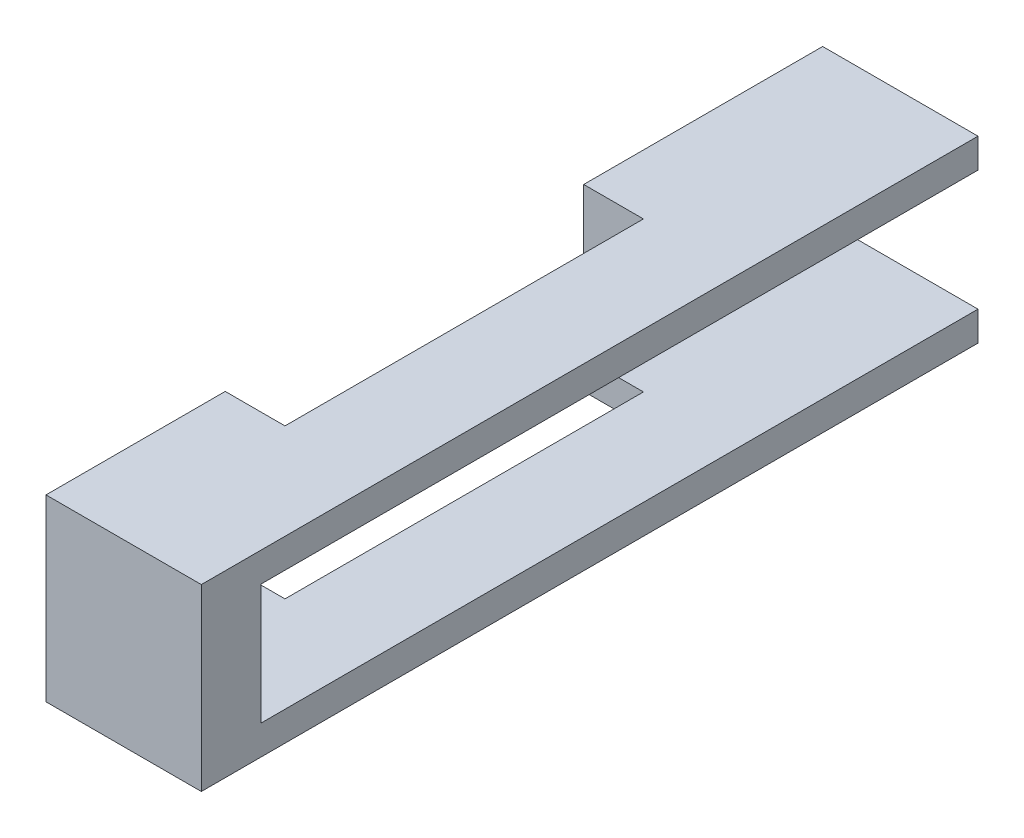
from build123d import *

# Parameters (mm, degrees)
SKETCH_1_W          = 30
SKETCH_1_H          = 30
EXTRUDE_1_DEPTH     = 30
SKETCH_2_W          = 20
SKETCH_2_H          = 20.05
CUT_EXTRUDE_1_DEPTH = 20
CUT_EXTRUDE_2_DEPTH = 20
SKETCH_4_W          = 5
SKETCH_4_H          = 30
CUT_EXTRUDE_3_DEPTH = 55
SKETCH_5_W          = 15
SKETCH_5_H          = 4.975
EXTRUDE_2_DEPTH     = 120
EXTRUDE_3_DEPTH     = 60
SKETCH_7_R          = 3.1
CUT_EXTRUDE_4_DEPTH = 60
CUT_EXTRUDE_5_REACH = 155.704
SKETCH_8_W          = 20.1
SKETCH_8_H          = 20.15
EXTRUDE_4_DEPTH     = 1
SKETCH_10_R         = 3.1
CUT_EXTRUDE_6_DEPTH = 10
SKETCH_12_W         = 26
SKETCH_12_H         = 20
CUT_EXTRUDE_8_DEPTH = 87


with BuildPart() as part:
    # 草图1 → 凸台-拉伸1 (new body)
    with BuildSketch(Plane(origin=(0, 0, 0), x_dir=(1, 0, 0), z_dir=(0, 1, 0))):
        Rectangle(SKETCH_1_W, SKETCH_1_H)
    extrude(amount=EXTRUDE_1_DEPTH)

    # 草图2 → 切除-拉伸1 (cut)
    with BuildSketch(Plane(origin=(15, 0, 0), x_dir=(0, 0, -1), z_dir=(1, 0, 0))):
        with Locations((5, 15)):
            Rectangle(SKETCH_2_W, SKETCH_2_H)
    extrude(amount=-CUT_EXTRUDE_1_DEPTH, mode=Mode.SUBTRACT)

    # 草图3 → 切除-拉伸2 (cut)
    with BuildSketch(Plane(origin=(-5, 0, 0), x_dir=(0, 0, -1), z_dir=(1, 0, 0))):
        with BuildLine():
            ThreePointArc((7.189292698, 17.194765929), (5, 18.1), (2.810707302, 17.194765929))
            Line((2.810707302, 17.194765929), (5, 15))
            Line((5, 15), (7.189292698, 17.194765929))
        make_face()
        with BuildLine():
            Line((5, 15), (2.810707302, 17.194765929))
            ThreePointArc((2.810707302, 17.194765929), (1.9, 15), (2.810707302, 12.805234071))
            Line((2.810707302, 12.805234071), (5, 15))
        make_face()
        with BuildLine():
            Line((7.189292698, 17.194765929), (5, 15))
            Line((5, 15), (7.189292698, 12.805234071))
            ThreePointArc((7.189292698, 12.805234071), (7.86328547, 13.81189381), (8.1, 15))
            ThreePointArc((8.1, 15), (7.86328547, 16.18810619), (7.189292698, 17.194765929))
        make_face()
        with BuildLine():
            Line((7.189292698, 12.805234071), (5, 15))
            Line((5, 15), (2.810707302, 12.805234071))
            ThreePointArc((2.810707302, 12.805234071), (5, 11.9), (7.189292698, 12.805234071))
        make_face()
        with BuildLine():
            ThreePointArc((7.189292698, 17.194765929), (5, 18.1), (2.810707302, 17.194765929))
            Line((2.810707302, 17.194765929), (5, 15))
            Line((5, 15), (7.189292698, 17.194765929))
        make_face()
        with BuildLine():
            Line((5, 15), (2.810707302, 17.194765929))
            ThreePointArc((2.810707302, 17.194765929), (1.9, 15), (2.810707302, 12.805234071))
            Line((2.810707302, 12.805234071), (5, 15))
        make_face()
        with BuildLine():
            Line((7.189292698, 17.194765929), (5, 15))
            Line((5, 15), (7.189292698, 12.805234071))
            ThreePointArc((7.189292698, 12.805234071), (7.86328547, 13.81189381), (8.1, 15))
            ThreePointArc((8.1, 15), (7.86328547, 16.18810619), (7.189292698, 17.194765929))
        make_face()
        with BuildLine():
            Line((7.189292698, 12.805234071), (5, 15))
            Line((5, 15), (2.810707302, 12.805234071))
            ThreePointArc((2.810707302, 12.805234071), (5, 11.9), (7.189292698, 12.805234071))
        make_face()
        with BuildLine():
            ThreePointArc((7.189292698, 17.194765929), (5, 18.1), (2.810707302, 17.194765929))
            Line((2.810707302, 17.194765929), (5, 15))
            Line((5, 15), (7.189292698, 17.194765929))
        make_face()
        with BuildLine():
            Line((5, 15), (2.810707302, 17.194765929))
            ThreePointArc((2.810707302, 17.194765929), (1.9, 15), (2.810707302, 12.805234071))
            Line((2.810707302, 12.805234071), (5, 15))
        make_face()
        with BuildLine():
            Line((7.189292698, 17.194765929), (5, 15))
            Line((5, 15), (7.189292698, 12.805234071))
            ThreePointArc((7.189292698, 12.805234071), (7.86328547, 13.81189381), (8.1, 15))
            ThreePointArc((8.1, 15), (7.86328547, 16.18810619), (7.189292698, 17.194765929))
        make_face()
        with BuildLine():
            Line((7.189292698, 12.805234071), (5, 15))
            Line((5, 15), (2.810707302, 12.805234071))
            ThreePointArc((2.810707302, 12.805234071), (5, 11.9), (7.189292698, 12.805234071))
        make_face()
        with BuildLine():
            ThreePointArc((7.189292698, 17.194765929), (5, 18.1), (2.810707302, 17.194765929))
            Line((2.810707302, 17.194765929), (5, 15))
            Line((5, 15), (7.189292698, 17.194765929))
        make_face()
        with BuildLine():
            Line((5, 15), (2.810707302, 17.194765929))
            ThreePointArc((2.810707302, 17.194765929), (1.9, 15), (2.810707302, 12.805234071))
            Line((2.810707302, 12.805234071), (5, 15))
        make_face()
        with BuildLine():
            Line((7.189292698, 17.194765929), (5, 15))
            Line((5, 15), (7.189292698, 12.805234071))
            ThreePointArc((7.189292698, 12.805234071), (7.86328547, 13.81189381), (8.1, 15))
            ThreePointArc((8.1, 15), (7.86328547, 16.18810619), (7.189292698, 17.194765929))
        make_face()
        with BuildLine():
            Line((7.189292698, 12.805234071), (5, 15))
            Line((5, 15), (2.810707302, 12.805234071))
            ThreePointArc((2.810707302, 12.805234071), (5, 11.9), (7.189292698, 12.805234071))
        make_face()
    extrude(amount=-CUT_EXTRUDE_2_DEPTH, mode=Mode.SUBTRACT)

    # 草图4 → 切除-拉伸3 (cut)
    with BuildSketch(Plane.XZ):
        with Locations((-12.5, 0)):
            Rectangle(SKETCH_4_W, SKETCH_4_H)
    extrude(amount=-CUT_EXTRUDE_3_DEPTH, mode=Mode.SUBTRACT)

    # 草图5 → 凸台-拉伸2 (add)
    with BuildSketch(Plane(origin=(0, 0, -15), x_dir=(-1, 0, 0), z_dir=(0, 0, -1))):
        with Locations((-7.5, 27.5125)):
            Rectangle(SKETCH_5_W, SKETCH_5_H)
        with Locations((-7.5, 2.4875)):
            Rectangle(SKETCH_5_W, SKETCH_5_H)
    extrude(amount=EXTRUDE_2_DEPTH)

    # 草图6 → 凸台-拉伸3 (add)
    with BuildSketch(Plane(origin=(0, 0, -135), x_dir=(-1, 0, 0), z_dir=(0, 0, -1))):
        Polygon((5, 4.975), (0, 4.975), (0, 0), (10, 0), (10, 30), (0, 30), (0, 25.025), (5, 25.025), align=None)
    extrude(amount=-EXTRUDE_3_DEPTH)

    # 草图7 → 切除-拉伸4 (cut)
    with BuildSketch(Plane.ZY.offset(10)):
        with Locations((-85, 15)):
            Circle(SKETCH_7_R)
    extrude(amount=-CUT_EXTRUDE_4_DEPTH, mode=Mode.SUBTRACT)

    # 切除-拉伸5: up to this face of the body (flat: up to its plane)
    cut_extrude_5_end = Plane(part.part.faces().sort_by_distance((5, 15, 5))[0])
    # 草图8 → 切除-拉伸5 (cut, up to the picked face)
    with BuildSketch(Plane(origin=(0, 0, -135), x_dir=(-1, 0, 0), z_dir=(0, 0, -1)), mode=Mode.PRIVATE) as cut_extrude_5_sk1:
        with Locations((-5, 15)):
            Rectangle(SKETCH_8_W, SKETCH_8_H)
    cut_extrude_5_tool1 = split(extrude(cut_extrude_5_sk1.sketch, amount=-CUT_EXTRUDE_5_REACH, mode=Mode.PRIVATE), bisect_by=cut_extrude_5_end, keep=Keep.BOTH, mode=Mode.PRIVATE)
    add(cut_extrude_5_tool1.solids().sort_by(Axis((5, 15, -135), (0, 0, 1)))[0], mode=Mode.SUBTRACT)

    # 草图9 → 凸台-拉伸4 (add)
    with BuildSketch(Plane(origin=(15, 0, 0), x_dir=(0, 0, -1), z_dir=(1, 0, 0))):
        Polygon((135, 4.925), (-5, 4.925), (-5, 25.075), (135, 25.075), (135, 30), (-15, 30), (-15, 0), (135, 0), align=None)
    extrude(amount=EXTRUDE_4_DEPTH)

    # 草图10 → 切除-拉伸6 (cut)
    # profile 1 of 9: a face of its own
    with BuildSketch(Plane.ZY.offset(10)):
        with BuildLine():
            ThreePointArc((-99.75, 15), (-99.948207558, 16.428948256), (-100.527864045, 17.75))
            ThreePointArc((-100.527864045, 17.75), (-101.830321577, 19.185168897), (-103.564729991, 20.05))
            Line((-103.564729991, 20.05), (-106.435270009, 20.05))
            ThreePointArc((-106.435270009, 20.05), (-108.169678423, 19.185168897), (-109.472135955, 17.75))
            ThreePointArc((-109.472135955, 17.75), (-110.25, 15), (-109.472135955, 12.25))
            ThreePointArc((-109.472135955, 12.25), (-108.169678423, 10.814831103), (-106.435270009, 9.95))
            Line((-106.435270009, 9.95), (-103.564729991, 9.95))
            ThreePointArc((-103.564729991, 9.95), (-101.830321577, 10.814831103), (-100.527864045, 12.25))
            ThreePointArc((-100.527864045, 12.25), (-99.948207558, 13.571051744), (-99.75, 15))
        make_face()
    # profile 2 of 9: a face of its own
    with BuildSketch(Plane.ZY.offset(10)):
        with BuildLine():
            Line((-106.435270009, 20.05), (-103.564729991, 20.05))
            ThreePointArc((-103.564729991, 20.05), (-105, 20.25), (-106.435270009, 20.05))
        make_face()
    # profile 3 of 9: a face of its own
    with BuildSketch(Plane.ZY.offset(10)):
        with BuildLine():
            ThreePointArc((-106.435270009, 9.95), (-105, 9.75), (-103.564729991, 9.95))
            Line((-103.564729991, 9.95), (-106.435270009, 9.95))
        make_face()
    # profile 4 of 9: a face of its own
    with BuildSketch(Plane.ZY.offset(10)):
        with BuildLine():
            ThreePointArc((-79.75, 15), (-79.948207558, 16.428948256), (-80.527864045, 17.75))
            ThreePointArc((-80.527864045, 17.75), (-81.830321577, 19.185168897), (-83.564729991, 20.05))
            Line((-83.564729991, 20.05), (-86.435270009, 20.05))
            ThreePointArc((-86.435270009, 20.05), (-88.169678423, 19.185168897), (-89.472135955, 17.75))
            ThreePointArc((-89.472135955, 17.75), (-90.25, 15), (-89.472135955, 12.25))
            ThreePointArc((-89.472135955, 12.25), (-88.169678423, 10.814831103), (-86.435270009, 9.95))
            Line((-86.435270009, 9.95), (-83.564729991, 9.95))
            ThreePointArc((-83.564729991, 9.95), (-81.830321577, 10.814831103), (-80.527864045, 12.25))
            ThreePointArc((-80.527864045, 12.25), (-79.948207558, 13.571051744), (-79.75, 15))
        make_face()
        with Locations((-85, 15)):
            Circle(SKETCH_10_R, mode=Mode.SUBTRACT)
    # profile 5 of 9: a face of its own
    with BuildSketch(Plane.ZY.offset(10)):
        with BuildLine():
            Line((-86.435270009, 20.05), (-83.564729991, 20.05))
            ThreePointArc((-83.564729991, 20.05), (-85, 20.25), (-86.435270009, 20.05))
        make_face()
    # profile 6 of 9: a face of its own
    with BuildSketch(Plane.ZY.offset(10)):
        with BuildLine():
            ThreePointArc((-86.435270009, 9.95), (-85, 9.75), (-83.564729991, 9.95))
            Line((-83.564729991, 9.95), (-86.435270009, 9.95))
        make_face()
    # profile 7 of 9: a face of its own
    with BuildSketch(Plane.ZY.offset(10)):
        with BuildLine():
            ThreePointArc((0.25, 15), (0.051792442, 16.428948256), (-0.527864045, 17.75))
            ThreePointArc((-0.527864045, 17.75), (-1.830321577, 19.185168897), (-3.564729991, 20.05))
            Line((-3.564729991, 20.05), (-6.435270009, 20.05))
            ThreePointArc((-6.435270009, 20.05), (-8.169678423, 19.185168897), (-9.472135955, 17.75))
            ThreePointArc((-9.472135955, 17.75), (-10.25, 15), (-9.472135955, 12.25))
            ThreePointArc((-9.472135955, 12.25), (-8.169678423, 10.814831103), (-6.435270009, 9.95))
            Line((-6.435270009, 9.95), (-3.564729991, 9.95))
            ThreePointArc((-3.564729991, 9.95), (-1.830321577, 10.814831103), (-0.527864045, 12.25))
            ThreePointArc((-0.527864045, 12.25), (0.051792442, 13.571051744), (0.25, 15))
        make_face()
    # profile 8 of 9: a face of its own
    with BuildSketch(Plane.ZY.offset(10)):
        with BuildLine():
            Line((-6.435270009, 20.05), (-3.564729991, 20.05))
            ThreePointArc((-3.564729991, 20.05), (-5, 20.25), (-6.435270009, 20.05))
        make_face()
    # profile 9 of 9: a face of its own
    with BuildSketch(Plane.ZY.offset(10)):
        with BuildLine():
            ThreePointArc((-6.435270009, 9.95), (-5, 9.75), (-3.564729991, 9.95))
            Line((-3.564729991, 9.95), (-6.435270009, 9.95))
        make_face()
    extrude(amount=-CUT_EXTRUDE_6_DEPTH, mode=Mode.SUBTRACT)

    # 草图12 → 切除-拉伸8 (cut)
    with BuildSketch(Plane.XZ):
        with Locations((3, -125)):
            Rectangle(SKETCH_12_W, SKETCH_12_H)
    extrude(amount=-CUT_EXTRUDE_8_DEPTH, mode=Mode.SUBTRACT)


solid = part.part
